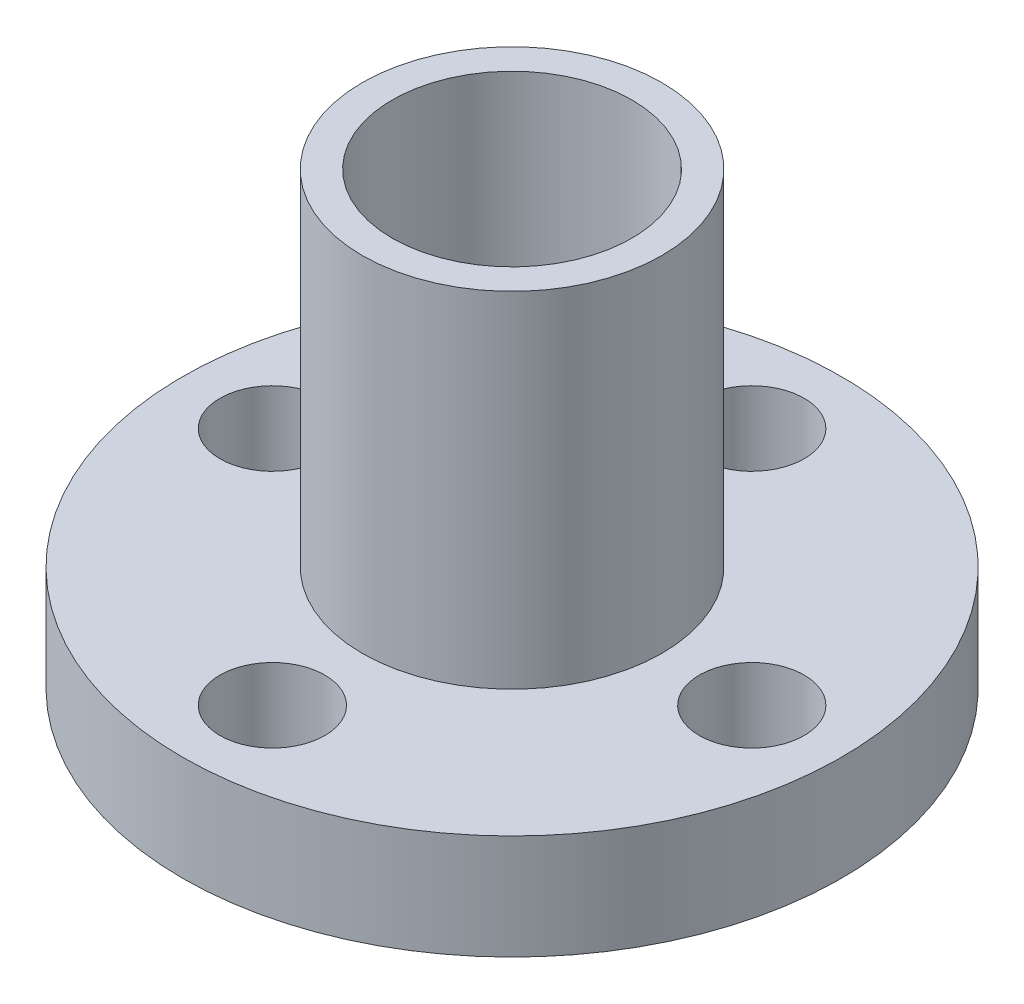
from build123d import *

# Parameters (mm, degrees)
SKETCH_1_R          = 11
EXTRUDE_1_DEPTH     = 3.5
SKETCH_2_R          = 5
EXTRUDE_2_DEPTH     = 11.5
SKETCH_3_R          = 4
CUT_EXTRUDE_1_DEPTH = 22.610182785
SKETCH_4_R          = 1.75
CUT_EXTRUDE_2_DEPTH = 20.345542122


with BuildPart() as part:
    # 草图1 → 凸台-拉伸1 (new body)
    with BuildSketch(Plane(origin=(0, 0, 0), x_dir=(1, 0, 0), z_dir=(0, 1, 0))):
        with Locations(Location((0, 0, 0), (0, 0, 270))):
            Circle(SKETCH_1_R)
    extrude(amount=EXTRUDE_1_DEPTH)

    # 草图2 → 凸台-拉伸2 (add)
    with BuildSketch(Plane(origin=(0, 3.5, 0), x_dir=(1, 0, 0), z_dir=(0, 1, 0))):
        with Locations(Location((0, 0, 0), (0, 0, 270))):
            Circle(SKETCH_2_R)
    extrude(amount=EXTRUDE_2_DEPTH)

    # 草图3 → 切除-拉伸1 (cut, through all)
    with BuildSketch(Plane(origin=(0, 15, 0), x_dir=(1, 0, 0), z_dir=(0, 1, 0))):
        with Locations(Location((0, 0, 0), (0, 0, 270))):
            Circle(SKETCH_3_R)
    extrude(amount=-CUT_EXTRUDE_1_DEPTH, mode=Mode.SUBTRACT)

    # 草图4 → 切除-拉伸2 (cut, through all)
    with BuildSketch(Plane(origin=(0, 3.5, 0), x_dir=(1, 0, 0), z_dir=(0, 1, 0))):
        with Locations(Location((0, 8, 0), (0, 0, 270))):
            Circle(SKETCH_4_R)
        with Locations(Location((8, 0, 0), (0, 0, 270))):
            Circle(SKETCH_4_R)
        with Locations(Location((0, -8, 0), (0, 0, 270))):
            Circle(SKETCH_4_R)
        with Locations(Location((-8, 0, 0), (0, 0, 270))):
            Circle(SKETCH_4_R)
    extrude(amount=-CUT_EXTRUDE_2_DEPTH, mode=Mode.SUBTRACT)


solid = part.part
